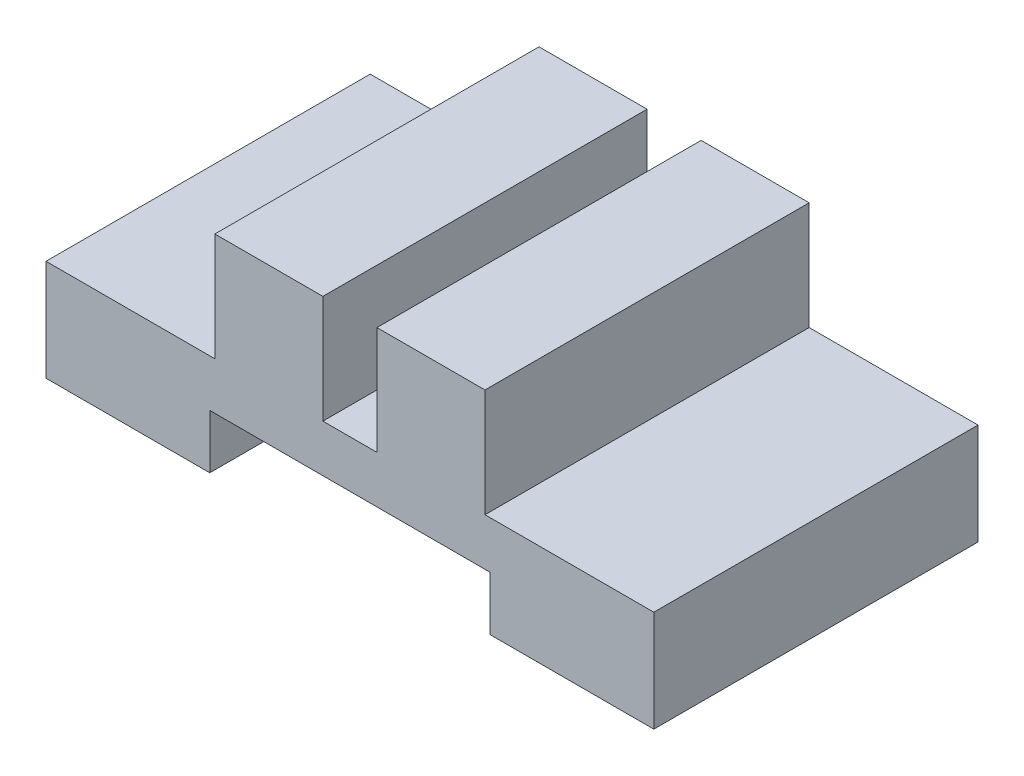
from build123d import *

# Parameters (mm, degrees)
SKETCH1_W           = 9
SKETCH1_H           = 4.8
BOSS_EXTRUDE1_DEPTH = 1.5
SKETCH2_W           = 4.15
SKETCH2_H           = 4.8
CUT_EXTRUDE1_DEPTH  = 0.8
SKETCH3_W           = 1.6
SKETCH3_H           = 4.8
BOSS_EXTRUDE2_DEPTH = 1.6


with BuildPart() as part:
    # Sketch1 → Boss-Extrude1 (new body)
    with BuildSketch(Plane(origin=(0, 0, 0), x_dir=(1, 0, 0), z_dir=(0, 1, 0))):
        Rectangle(SKETCH1_W, SKETCH1_H)
    extrude(amount=BOSS_EXTRUDE1_DEPTH)

    # Sketch2 → Cut-Extrude1 (cut)
    with BuildSketch(Plane(origin=(0, 0, 0), x_dir=(-1, 0, 0), z_dir=(0, -1, 0))):
        Rectangle(SKETCH2_W, SKETCH2_H)
    extrude(amount=-CUT_EXTRUDE1_DEPTH, mode=Mode.SUBTRACT)

    # Sketch3 → Boss-Extrude2 (add)
    with BuildSketch(Plane(origin=(0, 1.5, 0), x_dir=(1, 0, 0), z_dir=(0, 1, 0))):
        with Locations((1.2, 0)):
            Rectangle(SKETCH3_W, SKETCH3_H)
        with Locations((-1.2, 0)):
            Rectangle(SKETCH3_W, SKETCH3_H)
    extrude(amount=BOSS_EXTRUDE2_DEPTH)


solid = part.part
